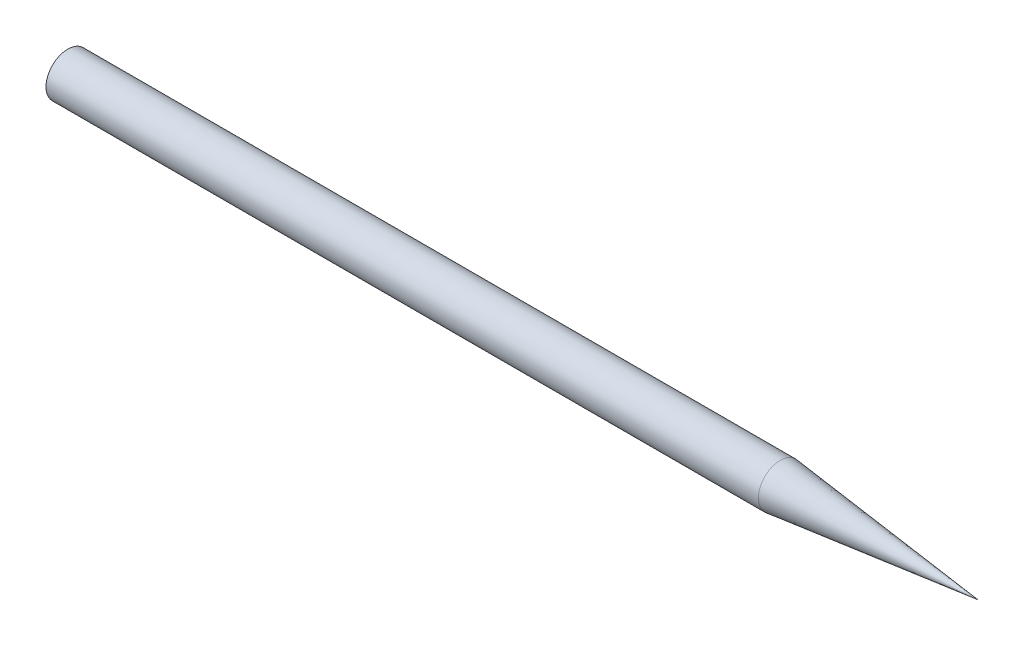
from build123d import *

# Parameters (mm, degrees)
SKETCH_1_W = 18
SKETCH_1_H = 0.55


with BuildPart() as part:
    # 草图1 → 旋转1 (revolve)
    with BuildSketch(Plane.XY, mode=Mode.PRIVATE) as revolve_1_sk:
        with Locations((9, 0.275)):
            Rectangle(SKETCH_1_W, SKETCH_1_H)
        Polygon((18, 0), (23, 0), (18, 0.55), align=None)
    revolve(revolve_1_sk.sketch.rotate(Axis((0, 0, 0), (1, 0, 0)), 90), axis=Axis((0, 0, 0), (1, 0, 0)))


solid = part.part
